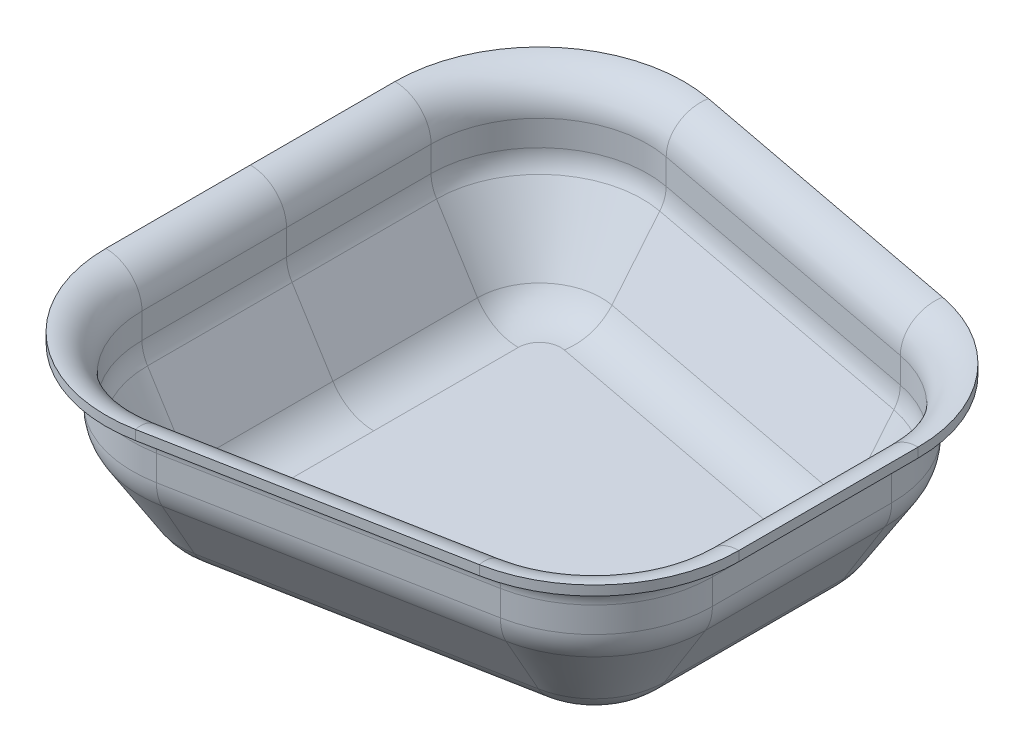
from build123d import *

# Parameters (mm, degrees)
BOSS_EXTRUDE2_START = 2.54
BOSS_EXTRUDE2_DEPTH = 2.54


with BuildPart() as part:
    # Sweep1: sweep along a path in Sketch3
    with BuildLine(Plane(origin=(0, 0, 0), x_dir=(1, 0, 0), z_dir=(0, 1, 0))) as sweep1_path:
        Line((-30.988229394, 75.53037161), (45.211770606, 61.05237161))
        ThreePointArc((45.211770606, 61.05237161), (67.44764437, 47.918620546), (76.2, 23.622))
        Line((76.2, 23.622), (76.2, -23.622))
        ThreePointArc((76.2, -23.622), (67.44764437, -47.918620546), (45.211770606, -61.05237161))
        Line((45.211770606, -61.05237161), (-30.988229394, -75.53037161))
        ThreePointArc((-30.988229394, -75.53037161), (-62.396620546, -67.44764437), (-76.2, -38.1))
        Line((-76.2, -38.1), (-76.2, 38.1))
        ThreePointArc((-76.2, 38.1), (-62.396620546, 67.44764437), (-30.988229394, 75.53037161))
    # Sketch2 → Sweep1 (sweep)
    with BuildSketch(Plane.XY):
        with BuildLine():
            Line((-66.675, 37.465), (-66.675, 30.734))
            ThreePointArc((-66.675, 30.734), (-66.304017394, 28.101588452), (-65.219967862, 25.674232841))
            Line((-65.219967862, 25.674232841), (-54.44795715, 8.493643788))
            ThreePointArc((-54.44795715, 8.493643788), (-49.836628957, 4.127648226), (-43.688, 2.54))
            Line((-43.688, 2.54), (-43.688, 0))
            ThreePointArc((-43.688, 0), (-51.066354749, 1.905177871), (-56.59994858, 7.144372546))
            Line((-56.59994858, 7.144372546), (-67.371959292, 24.324961599))
            ThreePointArc((-67.371959292, 24.324961599), (-68.745088699, 27.39961204), (-69.215, 30.734))
            Line((-69.215, 30.734), (-69.215, 37.465))
            ThreePointArc((-69.215, 37.465), (-71.260859133, 42.404140867), (-76.2, 44.45))
            Line((-76.2, 44.45), (-76.2, 46.99))
            ThreePointArc((-76.2, 46.99), (-69.464807909, 44.200192091), (-66.675, 37.465))
        make_face()
    sweep(path=sweep1_path.line)

    # Sketch5 → Boss-Extrude2 (add)
    with BuildSketch(Plane(origin=(0, 0, 0), x_dir=(1, 0, 0), z_dir=(0, 1, 0)).offset(BOSS_EXTRUDE2_START)):
        with BuildLine():
            Line((43.688, 23.622), (43.688, -23.622))
            ThreePointArc((43.688, -23.622), (42.404321174, -27.185504347), (39.143059689, -29.111787836))
            Line((39.143059689, -29.111787836), (-37.056940311, -43.589787836))
            ThreePointArc((-37.056940311, -43.589787836), (-41.663504347, -42.404321174), (-43.688, -38.1))
            Line((-43.688, -38.1), (-43.688, 0))
            Line((-43.688, 0), (-43.688, 38.1))
            ThreePointArc((-43.688, 38.1), (-41.663504347, 42.404321174), (-37.056940311, 43.589787836))
            Line((-37.056940311, 43.589787836), (39.143059689, 29.111787836))
            ThreePointArc((39.143059689, 29.111787836), (42.404321174, 27.185504347), (43.688, 23.622))
        make_face()
    extrude(amount=-BOSS_EXTRUDE2_DEPTH)


solid = part.part
